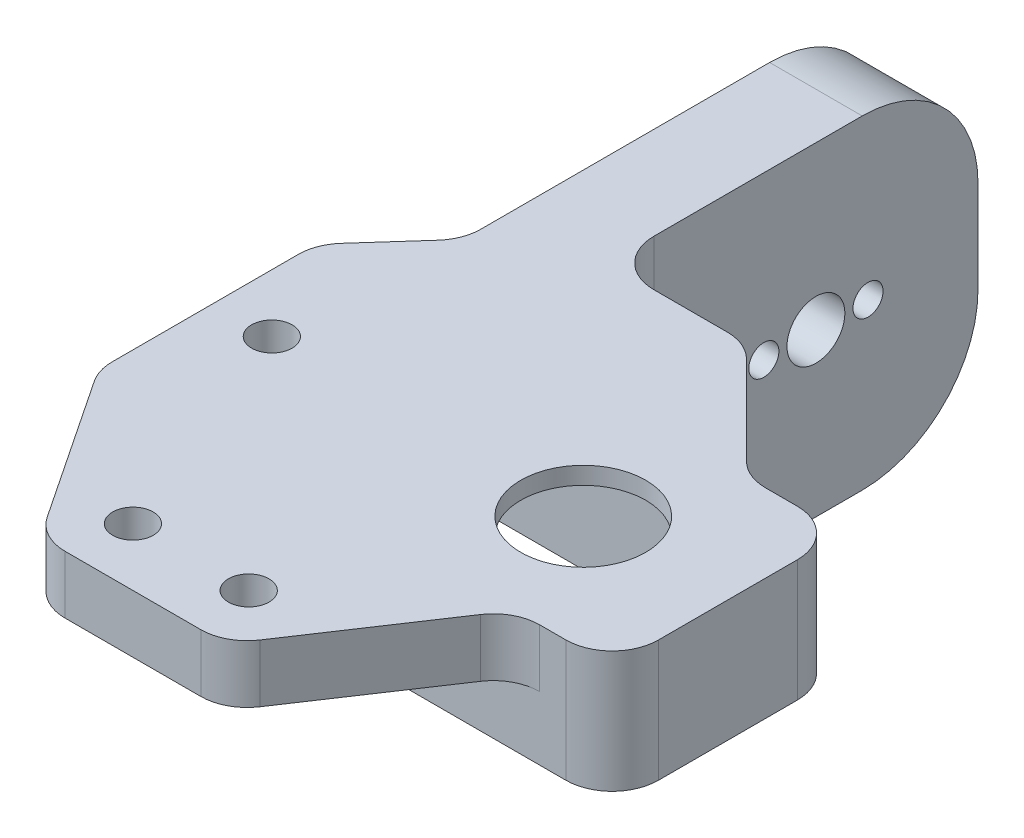
from build123d import *

# Parameters (mm, degrees)
BOSS_EXTRUDE1_DEPTH            = 38.4
SKETCH2_W                      = 38.4
SKETCH2_H                      = 15
BOSS_EXTRUDE2_DEPTH            = 5.5
SKETCH3_W                      = 38.4
SKETCH3_H                      = 23
BOSS_EXTRUDE3_DEPTH            = 27
SKETCH8_W                      = 38.4
SKETCH8_H                      = 5.5
BOSS_EXTRUDE4_DEPTH            = 20
CUT_EXTRUDE1_DEPTH             = 30.4
SKETCH10_W                     = 30.4
SKETCH10_H                     = 5.5
CUT_EXTRUDE2_DEPTH             = 32
BOSS_EXTRUDE5_DEPTH            = 5
CUT_EXTRUDE3_REACH             = 89.653
SKETCH17_W                     = 16.045256013
SKETCH17_H                     = 5.5
CUT_EXTRUDE4_DEPTH             = 94.189913617
CUT_EXTRUDE5_DEPTH             = 5.5
CUT_EXTRUDE6_DEPTH             = 3
SKETCH34_W                     = 23
SKETCH34_H                     = 13
CUT_EXTRUDE7_DEPTH             = 9
F_3_5_3_5_DIAMETER_HOLE1_D     = 3.5
F_10_8_10_8_DIAMETER_HOLE1_D   = 10.8
F_5_0_5_DIAMETER_HOLE1_D       = 5
F_5_0_5_DIAMETER_HOLE1_DEPTH   = 35.4
F_2_6_2_6_DIAMETER_HOLE1_D     = 2.6
F_2_6_2_6_DIAMETER_HOLE1_DEPTH = 14
F_2_0_2_DIAMETER_HOLE1_D       = 2
F_2_0_2_DIAMETER_HOLE1_DEPTH   = 7
FILLET1_R                      = 4
FILLET2_R                      = 8
FILLET3_R                      = 10


with BuildPart() as part:
    # Sketch1 → Boss-Extrude1 (new body)
    with BuildSketch(Plane(origin=(44.4, 0, 0), x_dir=(0, 0, -1), z_dir=(1, 0, 0))):
        Polygon((50, -5.5), (35, -5.5), (50, -23), align=None)
    extrude(amount=-BOSS_EXTRUDE1_DEPTH)

    # Sketch2 → Boss-Extrude2 (add)
    with BuildSketch(Plane(origin=(0, -5.5, 0), x_dir=(-1, 0, 0), z_dir=(0, 1, 0))):
        with Locations((-25.2, -42.5)):
            Rectangle(SKETCH2_W, SKETCH2_H)
    extrude(amount=BOSS_EXTRUDE2_DEPTH)

    # Sketch3 → Boss-Extrude3 (add)
    with BuildSketch(Plane(origin=(0, 0, -50), x_dir=(-1, 0, 0), z_dir=(0, 0, -1))):
        with Locations((-25.2, -11.5)):
            Rectangle(SKETCH3_W, SKETCH3_H)
    extrude(amount=BOSS_EXTRUDE3_DEPTH)

    # Sketch8 → Boss-Extrude4 (add)
    with BuildSketch(Plane.XY.offset(-35)):
        with Locations((25.2, -2.75)):
            Rectangle(SKETCH8_W, SKETCH8_H)
    extrude(amount=BOSS_EXTRUDE4_DEPTH)

    # Sketch9 → Cut-Extrude1 (cut)
    with BuildSketch(Plane(origin=(44.4, 0, 0), x_dir=(0, 0, -1), z_dir=(1, 0, 0))):
        Polygon((77, -23), (77, -5.5), (35, -5.5), (50, -23), align=None)
    extrude(amount=-CUT_EXTRUDE1_DEPTH, mode=Mode.SUBTRACT)

    # Sketch10 → Cut-Extrude2 (cut)
    with BuildSketch(Plane(origin=(0, 0, -77), x_dir=(-1, 0, 0), z_dir=(0, 0, -1))):
        with Locations((-29.2, -2.75)):
            Rectangle(SKETCH10_W, SKETCH10_H)
    extrude(amount=-CUT_EXTRUDE2_DEPTH, mode=Mode.SUBTRACT)

    # Sketch11 → Boss-Extrude5 (add)
    with BuildSketch(Plane(origin=(0, 0, 0), x_dir=(-1, 0, 0), z_dir=(0, 1, 0))):
        Polygon((-10, 0), (0, -15), (0, -33.819660113), (-6, -40.527864045), (-6, -77), (-14, -77), (-14, -45), (-44.4, -45), (-44.4, -15), (-36, -15), (-26, 0), align=None)
    extrude(amount=BOSS_EXTRUDE5_DEPTH)

    # Sketch17 → Cut-Extrude3 (cut, up to next)
    with BuildSketch(Plane(origin=(9.4, 0, 0), x_dir=(0, 0, -1), z_dir=(1, 0, 0)), mode=Mode.PRIVATE) as cut_extrude3_sk1:
        with Locations((23.022628007, -2.75)):
            Rectangle(SKETCH17_W, SKETCH17_H)
    cut_extrude3_tool1 = extrude(cut_extrude3_sk1.sketch, amount=-CUT_EXTRUDE3_REACH, mode=Mode.PRIVATE) & part.part
    add(cut_extrude3_tool1.solids().sort_by_distance((9.4, -2.75, -23.022628))[0], mode=Mode.SUBTRACT)

    # Sketch24 → Cut-Extrude4 (cut, through all)
    with BuildSketch(Plane(origin=(0, 5, 0), x_dir=(-1, 0, 0), z_dir=(0, 1, 0))):
        Polygon((-36, -35), (-44.4, -35), (-44.4, -45), (-26, -45), align=None)
    extrude(amount=-CUT_EXTRUDE4_DEPTH, mode=Mode.SUBTRACT)

    # Sketch25 → Cut-Extrude5 (cut)
    with BuildSketch(Plane.XZ.offset(5.5)):
        Polygon((36, -35), (14, -35), (14, -45), (26, -45), align=None)
    extrude(amount=-CUT_EXTRUDE5_DEPTH, mode=Mode.SUBTRACT)

    # Sketch33 → Cut-Extrude6 (cut)
    with BuildSketch(Plane.ZY.offset(-6)):
        with BuildLine():
            Line((-66.5, -12.5), (-59.5, -12.5))
            ThreePointArc((-59.5, -12.5), (-56, -9), (-59.5, -5.5))
            Line((-59.5, -5.5), (-66.5, -5.5))
            ThreePointArc((-66.5, -5.5), (-70, -9), (-66.5, -12.5))
        make_face()
    extrude(amount=-CUT_EXTRUDE6_DEPTH, mode=Mode.SUBTRACT)

    # Sketch34 → Cut-Extrude7 (cut)
    with BuildSketch(Plane.XZ.offset(5.5)):
        with Locations((26.9, -25)):
            Rectangle(SKETCH34_W, SKETCH34_H)
    extrude(amount=-CUT_EXTRUDE7_DEPTH, mode=Mode.SUBTRACT)

    # Ø3.5 (3.5) Diameter Hole1 (through all)
    with Locations(Plane(origin=(0, 0, 0), x_dir=(-1, 0, 0), z_dir=(0, -1, 0))):
        with Locations((-5, 25), (-13, 5), (-23, 5)):
            Hole(F_3_5_3_5_DIAMETER_HOLE1_D / 2)

    # Ø10.8 (10.8) Diameter Hole1 (through all)
    with Locations(Plane(origin=(0, 3.5, 0), x_dir=(-1, 0, 0), z_dir=(0, -1, 0))):
        with Locations((-31.9, 25)):
            Hole(F_10_8_10_8_DIAMETER_HOLE1_D / 2)

    # Ø5.0 (5) Diameter Hole1
    with Locations(Plane.ZY.offset(-9)):
        with Locations((-63, -9)):
            Hole(F_5_0_5_DIAMETER_HOLE1_D / 2, depth=F_5_0_5_DIAMETER_HOLE1_DEPTH)

    # Ø2.6 (2.6) Diameter Hole1
    with Locations(Plane(origin=(14, 0, 0), x_dir=(0, 0, -1), z_dir=(1, 0, 0))):
        with Locations((58.5, -9), (67.5, -9)):
            Hole(F_2_6_2_6_DIAMETER_HOLE1_D / 2, depth=F_2_6_2_6_DIAMETER_HOLE1_DEPTH)

    # Ø2.0 (2) Diameter Hole1
    with Locations(Plane(origin=(0, -5.5, 0), x_dir=(-1, 0, 0), z_dir=(0, -1, 0))):
        with Locations((-13.1, 25), (-40.7, 25)):
            Hole(F_2_0_2_DIAMETER_HOLE1_D / 2, depth=F_2_0_2_DIAMETER_HOLE1_DEPTH)

    # Fillet1
    fillet1_edges = [part.edges().sort_by_distance(p)[0] for p in [
        (9.4, -2.75, -15),
        (44.4, -0.25, -35),
        (36, 2.5, -35),
        (26, 2.5, -45),
        (14, 2.5, -45),
        (14, 0, -40),
        (14, -2.75, -35),
        (44.4, -0.25, -15),
        (10, 2.5, 0),
        (26, 2.5, 0),
        (36, 2.5, -15),
        (6, 2.5, -40.527864045),
        (0, 2.5, -33.819660113),
        (0, 2.5, -15),
    ]]
    fillet(fillet1_edges, radius=FILLET1_R)

    # Fillet2
    fillet2_edges = [part.edges().sort_by_distance(p)[0] for p in [
        (10, -23, -50),
    ]]
    fillet(fillet2_edges, radius=FILLET2_R)

    # Fillet3
    fillet3_edges = [part.edges().sort_by_distance(p)[0] for p in [
        (10, -23, -77),
        (10, 5, -77),
    ]]
    fillet(fillet3_edges, radius=FILLET3_R)


solid = part.part
